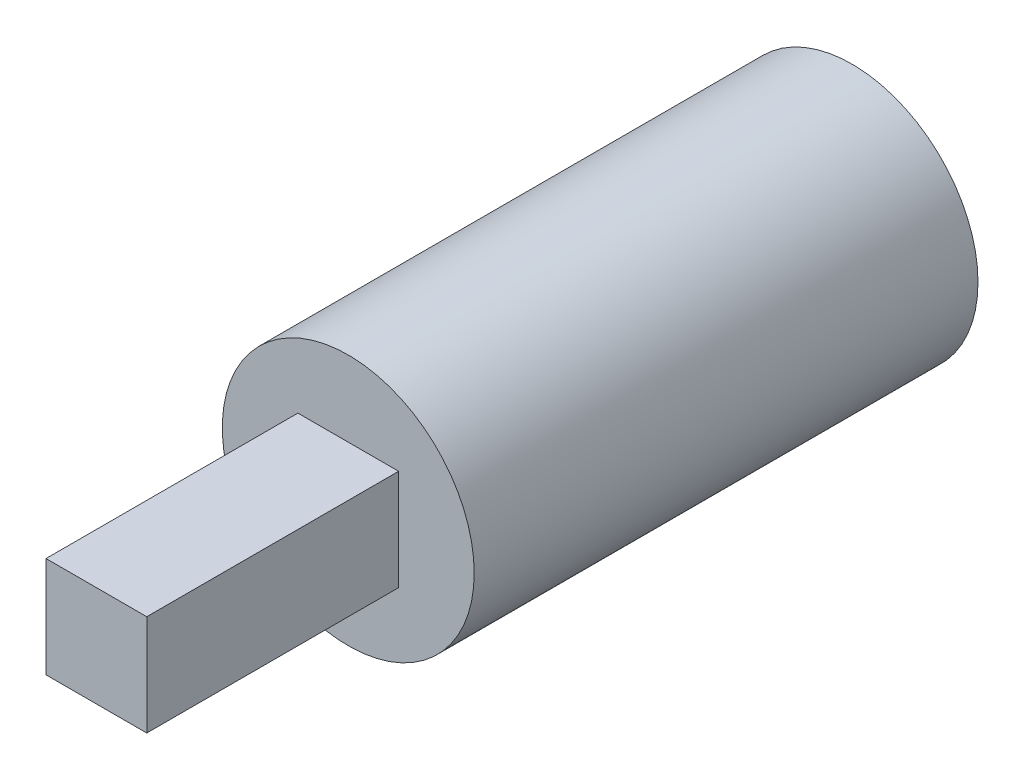
from build123d import *

# Parameters (mm, degrees)
SKETCH_2_R      = 2.5
EXTRUDE_1_DEPTH = 10
SKETCH_3_W      = 2
SKETCH_3_H      = 2
EXTRUDE_2_DEPTH = 5


with BuildPart() as part:
    # 草图2 → 凸台-拉伸1 (new body)
    with BuildSketch(Plane.XY):
        Circle(SKETCH_2_R)
    extrude(amount=EXTRUDE_1_DEPTH)

    # 草图3 → 凸台-拉伸2 (add)
    with BuildSketch(Plane.XY.offset(10)):
        Rectangle(SKETCH_3_W, SKETCH_3_H)
    extrude(amount=EXTRUDE_2_DEPTH)


solid = part.part
